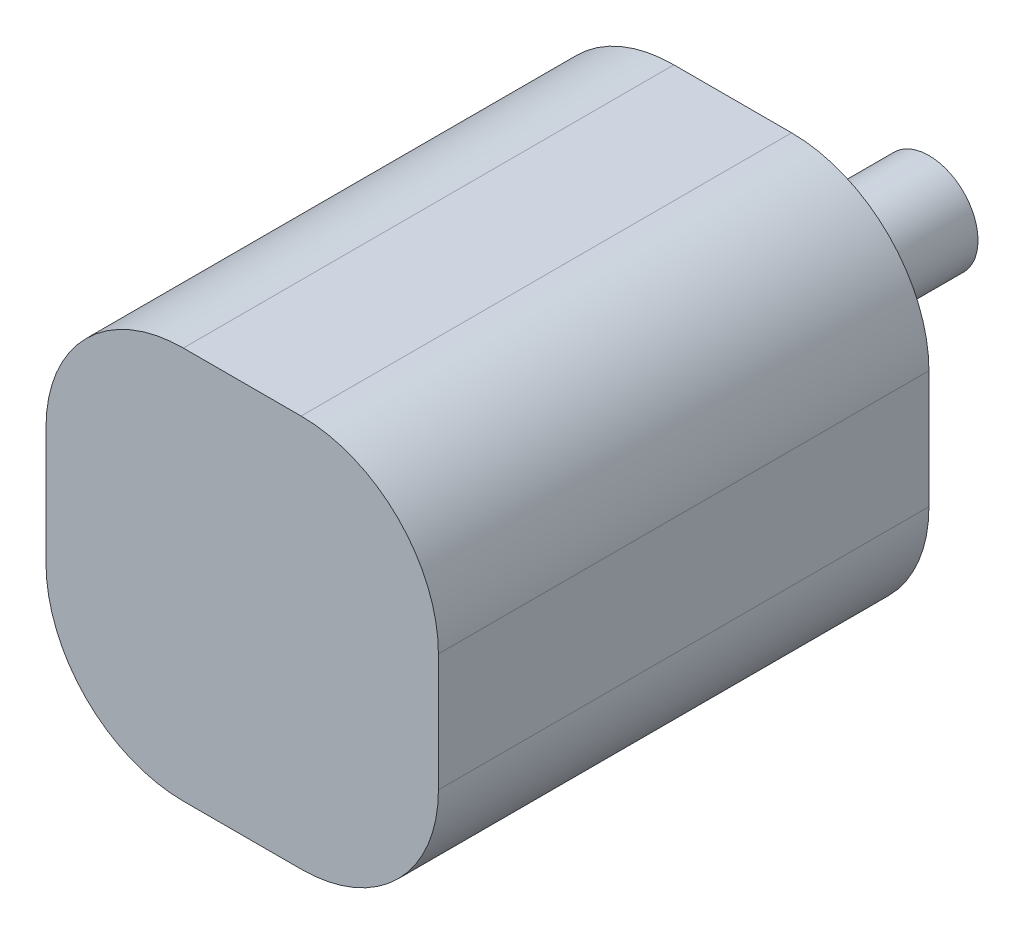
from build123d import *

# Parameters (mm, degrees)
SKETCH1_R           = 2.5
BOSS_EXTRUDE1_DEPTH = 10
SKETCH2_W           = 20
SKETCH2_H           = 20
BOSS_EXTRUDE2_DEPTH = 25
FILLET1_R           = 7


with BuildPart() as part:
    # Sketch1 → Boss-Extrude1 (new body)
    with BuildSketch(Plane.XY):
        Circle(SKETCH1_R)
    extrude(amount=BOSS_EXTRUDE1_DEPTH)

    # Sketch2 → Boss-Extrude2 (add)
    with BuildSketch(Plane.XY.offset(10)):
        Rectangle(SKETCH2_W, SKETCH2_H)
    extrude(amount=BOSS_EXTRUDE2_DEPTH)

    # Fillet1
    fillet1_edges = [part.edges().sort_by_distance(p)[0] for p in [
        (10, -10, 22.5),
        (10, 10, 22.5),
        (-10, 10, 22.5),
        (-10, -10, 22.5),
    ]]
    fillet(fillet1_edges, radius=FILLET1_R)


solid = part.part
